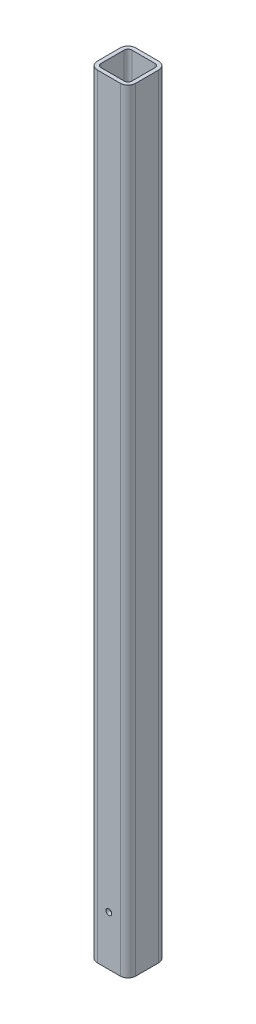
from build123d import *

# Parameters (mm, degrees)
COMPONENTE_ESTRUTURAL1_DEPTH = 806.238387173
ESBO_O3_R                    = 3
CORTE_EXTRUS_O1_DEPTH        = 76


with BuildPart() as part:
    # Sketch1 → Componente estrutural1 (new body)
    with BuildSketch(Plane(origin=(0, 1060.761370688, 0), x_dir=(-1, 0, 0), z_dir=(0, 1, 0))):
        with BuildLine():
            Line((-12, -20), (12, -20))
            ThreePointArc((12, -20), (17.656854249, -17.656854249), (20, -12))
            Line((20, -12), (20, 12))
            ThreePointArc((20, 12), (17.656854249, 17.656854249), (12, 20))
            Line((12, 20), (-12, 20))
            ThreePointArc((-12, 20), (-17.656854249, 17.656854249), (-20, 12))
            Line((-20, 12), (-20, -12))
            ThreePointArc((-20, -12), (-17.656854249, -17.656854249), (-12, -20))
        make_face()
        with BuildLine():
            Line((-12, -16), (12, -16))
            ThreePointArc((12, -16), (14.828427125, -14.828427125), (16, -12))
            Line((16, -12), (16, 12))
            ThreePointArc((16, 12), (14.828427125, 14.828427125), (12, 16))
            Line((12, 16), (-12, 16))
            ThreePointArc((-12, 16), (-14.828427125, 14.828427125), (-16, 12))
            Line((-16, 12), (-16, -12))
            ThreePointArc((-16, -12), (-14.828427125, -14.828427125), (-12, -16))
        make_face(mode=Mode.SUBTRACT)
    extrude(amount=COMPONENTE_ESTRUTURAL1_DEPTH)

    # Esboço3 → Corte-extrusão1 (cut)
    with BuildSketch(Plane(origin=(0, 0, -20), x_dir=(-1, 0, 0), z_dir=(0, 0, -1))):
        with Locations((0, 1112.604059558)):
            Circle(ESBO_O3_R)
    extrude(amount=-CORTE_EXTRUS_O1_DEPTH, mode=Mode.SUBTRACT)


solid = part.part
